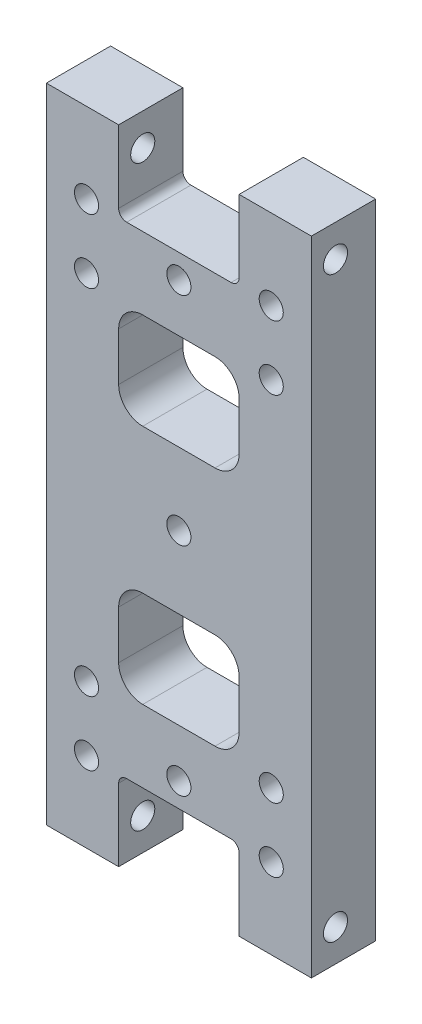
from build123d import *

# Parameters (mm, degrees)
SKETCH_1_W          = 33
SKETCH_1_H          = 80
EXTRUDE_1_DEPTH     = 8
SKETCH_2_W          = 15
SKETCH_2_H          = 10
CUT_EXTRUDE_1_DEPTH = 45.002840817
SKETCH_3_R          = 1.5
CUT_EXTRUDE_2_DEPTH = 45.002840817
SKETCH_4_R          = 1.5
CUT_EXTRUDE_3_DEPTH = 53.469038489
FILLET_2_R          = 1
SKETCH_5_R          = 1.5
CUT_EXTRUDE_4_DEPTH = 45.002840817
SKETCH_7_W          = 15
SKETCH_7_H          = 12
CUT_EXTRUDE_5_DEPTH = 45.002840817
FILLET_3_R          = 3
SKETCH_8_R          = 3
CUT_EXTRUDE_6_DEPTH = 3.5


with BuildPart() as part:
    # 草图1 → 凸台-拉伸1 (new body)
    with BuildSketch(Plane.XY):
        Rectangle(SKETCH_1_W, SKETCH_1_H)
    extrude(amount=EXTRUDE_1_DEPTH)

    # 草图2 → 切除-拉伸1 (cut, through all)
    with BuildSketch(Plane.XY.offset(8)):
        with Locations((0, 35)):
            Rectangle(SKETCH_2_W, SKETCH_2_H)
        with Locations((0, -35)):
            Rectangle(SKETCH_2_W, SKETCH_2_H)
    extrude(amount=-CUT_EXTRUDE_1_DEPTH, mode=Mode.SUBTRACT)

    # 草图3 → 切除-拉伸2 (cut, through all)
    with BuildSketch(Plane.XY.offset(8)):
        with Locations((11.5, 22)):
            Circle(SKETCH_3_R)
        with Locations((11.5, 30)):
            Circle(SKETCH_3_R)
        with Locations(Location((11.5, -30, 0), (0, 0, 180))):
            Circle(SKETCH_3_R)
        with Locations(Location((11.5, -22, 0), (0, 0, 180))):
            Circle(SKETCH_3_R)
        with Locations((-11.5, -22)):
            Circle(SKETCH_3_R)
        with Locations((-11.5, -30)):
            Circle(SKETCH_3_R)
        with Locations(Location((-11.5, 30, 0), (0, 0, 180))):
            Circle(SKETCH_3_R)
        with Locations(Location((-11.5, 22, 0), (0, 0, 180))):
            Circle(SKETCH_3_R)
    extrude(amount=-CUT_EXTRUDE_2_DEPTH, mode=Mode.SUBTRACT)

    # 草图4 → 切除-拉伸3 (cut, through all)
    with BuildSketch(Plane.ZY.offset(16.5)):
        with Locations((5, 36)):
            Circle(SKETCH_4_R)
        with Locations(Location((5, -36, 0), (0, 0, 180))):
            Circle(SKETCH_4_R)
    extrude(amount=-CUT_EXTRUDE_3_DEPTH, mode=Mode.SUBTRACT)

    # 圆角2
    fillet_2_edges = [part.edges().sort_by_distance(p)[0] for p in [
        (7.5, 30, 4),
        (-7.5, 30, 4),
        (-7.5, -30, 4),
        (7.5, -30, 4),
    ]]
    fillet(fillet_2_edges, radius=FILLET_2_R)

    # 草图5 → 切除-拉伸4 (cut, through all)
    with BuildSketch(Plane(origin=(0, 0, 0), x_dir=(-1, 0, 0), z_dir=(0, 0, -1))):
        Circle(SKETCH_5_R)
        with Locations((0, 27)):
            Circle(SKETCH_5_R)
        with Locations(Location((0, -27, 0), (0, 0, 180))):
            Circle(SKETCH_5_R)
    extrude(amount=-CUT_EXTRUDE_4_DEPTH, mode=Mode.SUBTRACT)

    # 草图7 → 切除-拉伸5 (cut, through all)
    with BuildSketch(Plane(origin=(0, 0, 0), x_dir=(-1, 0, 0), z_dir=(0, 0, -1))):
        with Locations((0, 15)):
            Rectangle(SKETCH_7_W, SKETCH_7_H)
        with Locations((0, -15)):
            Rectangle(SKETCH_7_W, SKETCH_7_H)
    extrude(amount=-CUT_EXTRUDE_5_DEPTH, mode=Mode.SUBTRACT)

    # 圆角3
    fillet_3_edges = [part.edges().sort_by_distance(p)[0] for p in [
        (-7.5, 21, 4),
        (-7.5, 9, 4),
        (7.5, 9, 4),
        (7.5, 21, 4),
        (7.5, -21, 4),
        (7.5, -9, 4),
        (-7.5, -9, 4),
        (-7.5, -21, 4),
    ]]
    fillet(fillet_3_edges, radius=FILLET_3_R)

    # 草图8 → 切除-拉伸6 (cut)
    with BuildSketch(Plane(origin=(0, 0, 0), x_dir=(-1, 0, 0), z_dir=(0, 0, -1))):
        with Locations((11.5, 30)):
            Circle(SKETCH_8_R)
        with Locations((-11.5, 30)):
            Circle(SKETCH_8_R)
        with Locations((-11.5, -30)):
            Circle(SKETCH_8_R)
        with Locations((11.5, -30)):
            Circle(SKETCH_8_R)
        Circle(SKETCH_8_R)
    extrude(amount=-CUT_EXTRUDE_6_DEPTH, mode=Mode.SUBTRACT)


solid = part.part
